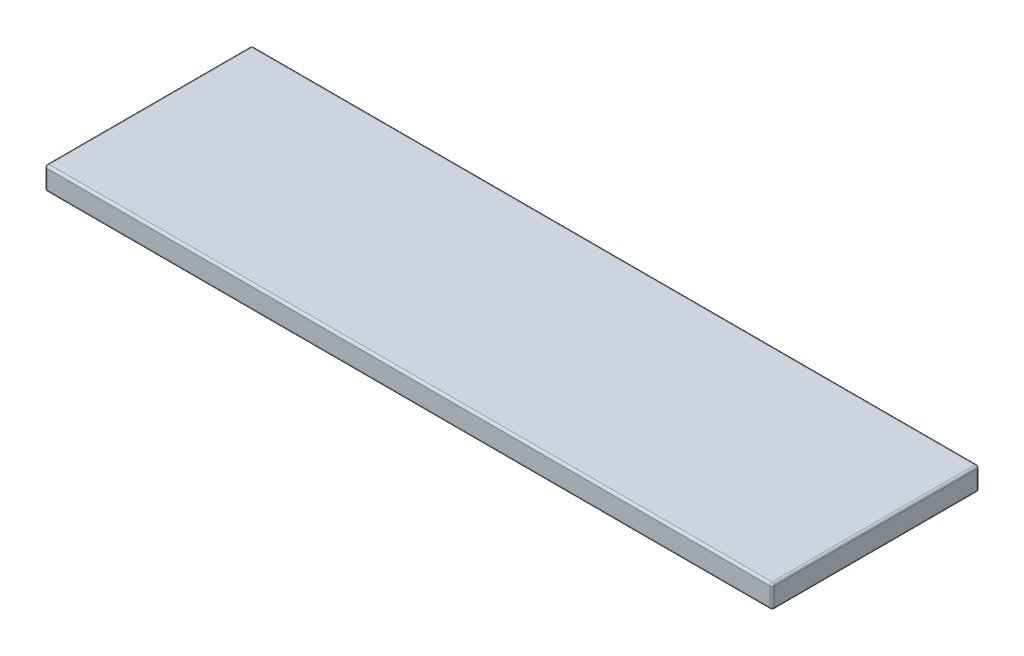
from build123d import *

# Parameters (mm, degrees)
ESBO_O1_W                = 158
ESBO_O1_H                = 45
RESSALTO_EXTRUS_O1_DEPTH = 5
FILETE1_R                = 0.5


with BuildPart() as part:
    # Esboço1 → Ressalto-extrusão1 (new body)
    with BuildSketch(Plane(origin=(0, 0, 0), x_dir=(1, 0, 0), z_dir=(0, 1, 0))):
        Rectangle(ESBO_O1_W, ESBO_O1_H)
    extrude(amount=RESSALTO_EXTRUS_O1_DEPTH)

    # Filete1
    filete1_edges = [part.edges().sort_by_distance(p)[0] for p in [
        (-79, 5, 0),
        (0, 5, 22.5),
        (79, 5, 0),
        (0, 0, 22.5),
        (-79, 0, 0),
        (0, 0, -22.5),
        (79, 0, 0),
        (0, 5, -22.5),
        (79, 2.5, 22.5),
        (-79, 2.5, 22.5),
        (-79, 2.5, -22.5),
        (79, 2.5, -22.5),
    ]]
    fillet(filete1_edges, radius=FILETE1_R)


solid = part.part
